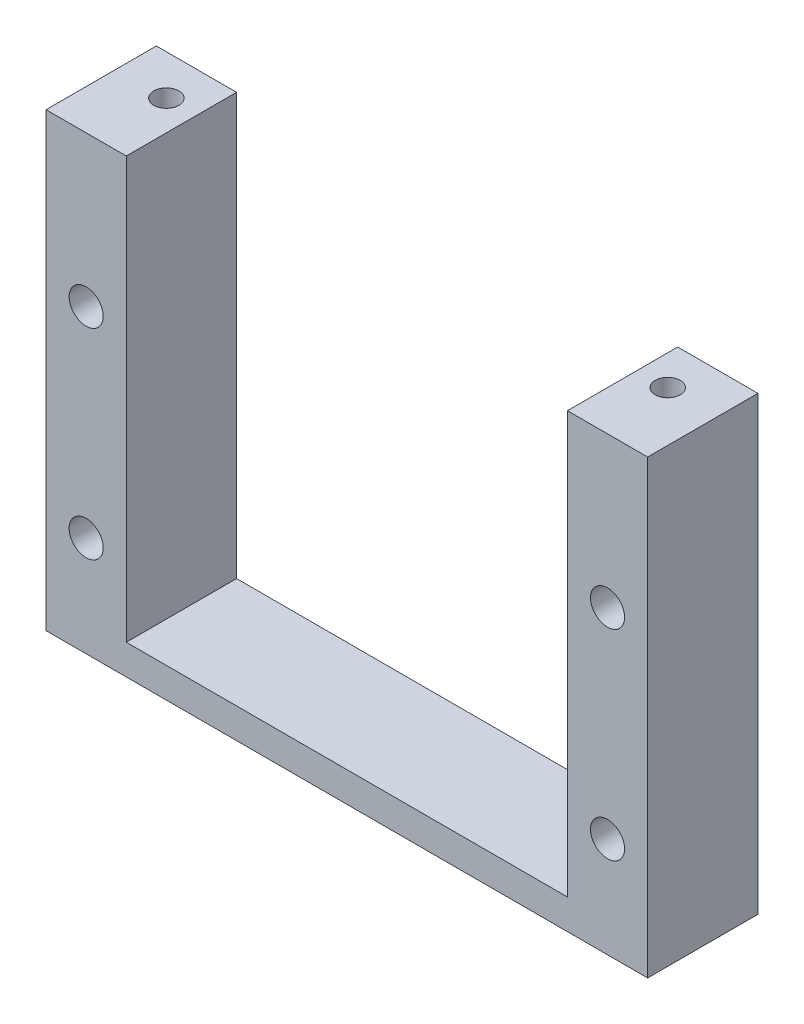
from build123d import *

# Parameters (mm, degrees)
SKETCH1_W                  = 60
SKETCH1_H                  = 45
BOSS_EXTRUDE1_DEPTH        = 11
SKETCH3_W                  = 44
SKETCH3_H                  = 11
FAN_DEPTH                  = 42
SKETCH4_R                  = 1.25
SCREWS_DEPTH               = 10
F_3_4_3_4_DIAMETER_HOLE1_D = 3.4


with BuildPart() as part:
    # Sketch1 → Boss-Extrude1 (new body)
    with BuildSketch(Plane.XY):
        with Locations((30, 22.5)):
            Rectangle(SKETCH1_W, SKETCH1_H)
    extrude(amount=BOSS_EXTRUDE1_DEPTH)

    # Sketch3 → fan (cut)
    with BuildSketch(Plane(origin=(0, 45, 0), x_dir=(1, 0, 0), z_dir=(0, 1, 0))):
        with Locations((30, -5.5)):
            Rectangle(SKETCH3_W, SKETCH3_H)
    extrude(amount=-FAN_DEPTH, mode=Mode.SUBTRACT)

    # Sketch4 → screws (cut)
    with BuildSketch(Plane(origin=(0, 45, 0), x_dir=(1, 0, 0), z_dir=(0, 1, 0))):
        with Locations(Location((5, -4, 0), (0, 0, 270))):
            Circle(SKETCH4_R)
        with Locations(Location((55, -4, 0), (0, 0, 270))):
            Circle(SKETCH4_R)
    extrude(amount=-SCREWS_DEPTH, mode=Mode.SUBTRACT)

    # Ø3.4 (3.4) Diameter Hole1 (through all)
    with Locations(Plane(origin=(0, 0, 0), x_dir=(-1, 0, 0), z_dir=(0, 0, -1))):
        with Locations((-4, 30), (-4, 10), (-56, 10), (-56, 30)):
            Hole(F_3_4_3_4_DIAMETER_HOLE1_D / 2)


solid = part.part
